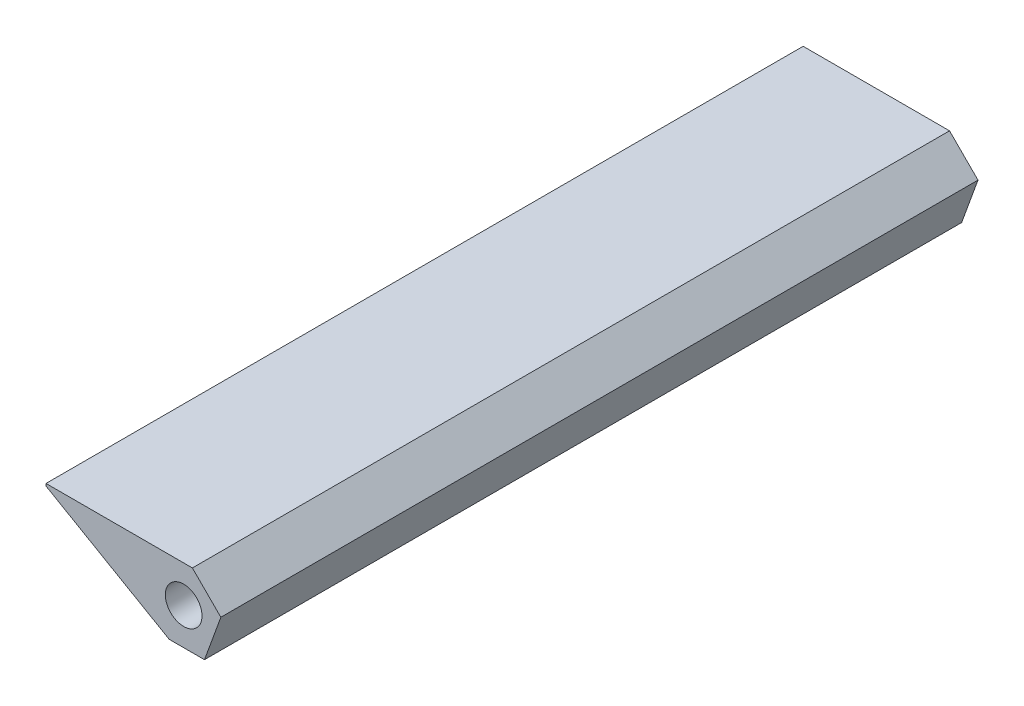
from build123d import *

# Parameters (mm, degrees)
SKIZZE1_R                       = 4
AUFSATZ_LINEAR_AUSTRAGEN1_DEPTH = 82.5


with BuildPart() as part:
    # Skizze1 → Aufsatz-Linear austragen1 (new, symmetric)
    with BuildSketch(Plane.XY):
        Polygon((-30, 8), (1.899494937, 8), (8.103084379, 1.796410558), (4.537482533, -8), (-3.153212483, -8), (-30, 7.5), align=None)
        Circle(SKIZZE1_R, mode=Mode.SUBTRACT)
    extrude(amount=AUFSATZ_LINEAR_AUSTRAGEN1_DEPTH, both=True)


solid = part.part
